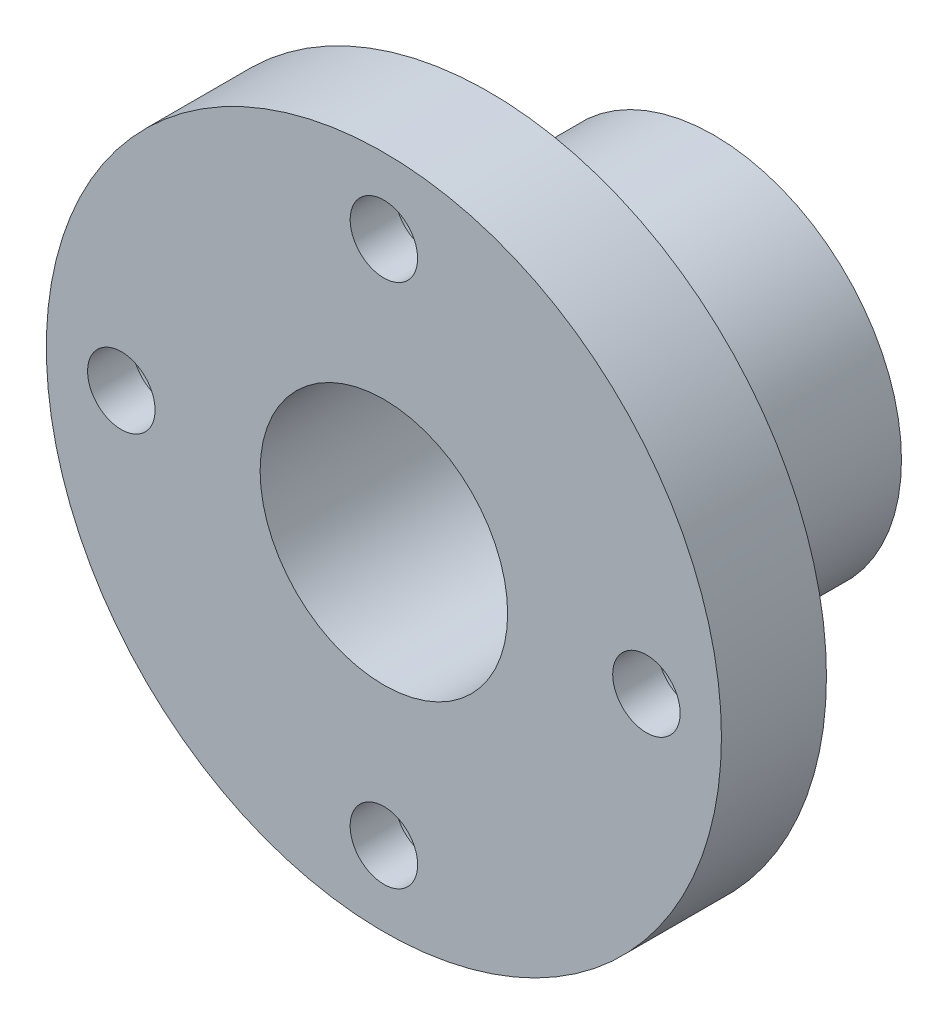
from build123d import *

# Parameters (mm, degrees)
SKETCH_1_R               = 12.5
EXTRUDE_1_DEPTH          = 15
SKETCH_2_R               = 22.5
EXTRUDE_2_DEPTH          = 7
M18X1_5_1_D              = 16.5
M18X1_5_1_DEPTH          = 43.5
M18X1_5_1_TIP            = 4.957100107
PATTERN_CIRCULAR_1_COUNT = 4


with BuildPart() as part:
    # 草图1 → 拉伸1 (new body)
    with BuildSketch(Plane.XY):
        Circle(SKETCH_1_R)
    extrude(amount=EXTRUDE_1_DEPTH)

    # 草图2 → 拉伸2 (add)
    with BuildSketch(Plane.XY.offset(15)):
        Circle(SKETCH_2_R)
    extrude(amount=EXTRUDE_2_DEPTH)

    # M18x1.5 螺纹孔1
    with Locations(Plane(origin=(0, 0, 0), x_dir=(-1, 0, 0), z_dir=(0, 0, -1))):
        with Locations((0, 0)):
            Hole(M18X1_5_1_D / 2, depth=M18X1_5_1_DEPTH)
            with Locations((0, 0, -(M18X1_5_1_DEPTH + M18X1_5_1_TIP / 2))):  # 118° drill point
                Cone(0, M18X1_5_1_D / 2, M18X1_5_1_TIP, mode=Mode.SUBTRACT)

    # 草图5 → M4 六角凹头螺钉的柱形沉头孔1 (revolve, cut)
    with BuildSketch(Plane(origin=(0, 17.5, 15), x_dir=(0, 1, 0), z_dir=(1, 0, 0))):
        Polygon((0, 0), (0, 7), (2.25, 7), (2.25, 4), (4, 4), (4, 0.025), (4.025, 0), align=None)
    hole_wizard_m4_1 = revolve(axis=Axis((0, 17.5, 8.65), (0, 0, 1)), mode=Mode.SUBTRACT)

    # 阵列(圆周)1: M4 六角凹头螺钉的柱形沉头孔1 ×4 about axis
    pattern_circular_1_axis = Axis((0, 0, 0), (0, 0, 1))
    for i in range(1, PATTERN_CIRCULAR_1_COUNT):
        add(hole_wizard_m4_1.rotate(pattern_circular_1_axis, i * 360 / PATTERN_CIRCULAR_1_COUNT), mode=Mode.SUBTRACT)


solid = part.part
